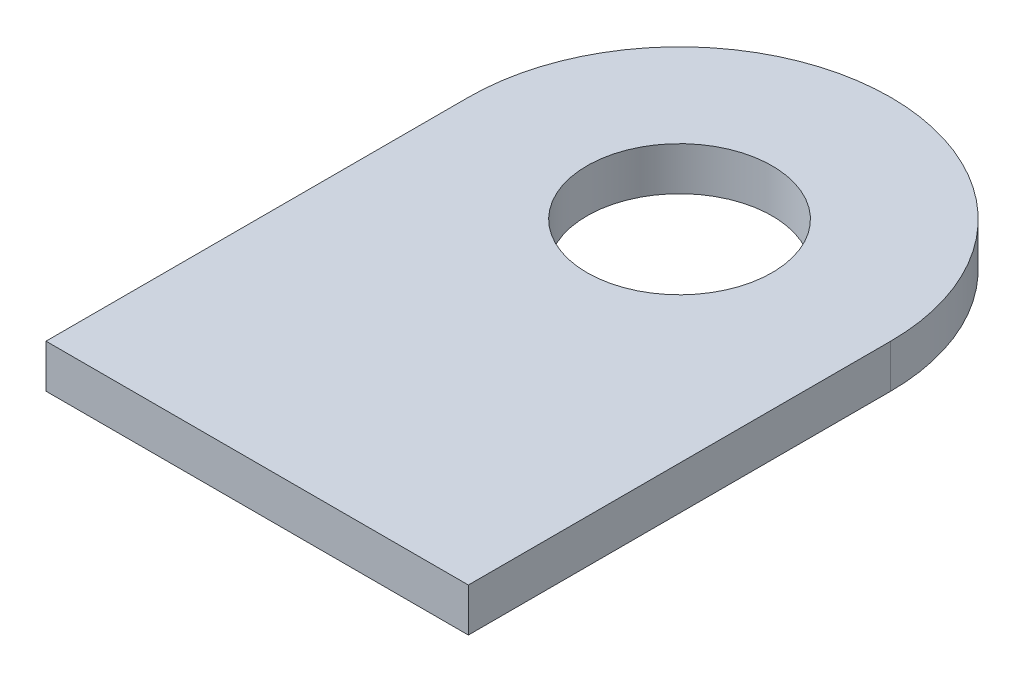
from build123d import *

# Parameters (mm, degrees)
SKETCH1_R           = 3.28803
BOSS_EXTRUDE1_DEPTH = 1.54


with BuildPart() as part:
    # Sketch1 → Boss-Extrude1 (new body)
    with BuildSketch(Plane(origin=(0, 0, 0), x_dir=(1, 0, 0), z_dir=(0, 1, 0))):
        with BuildLine():
            Line((0, 0), (15, 0))
            Line((15, 0), (15, 15))
            ThreePointArc((15, 15), (7.5, 22.5), (0, 15))
            Line((0, 15), (0, 0))
        make_face()
        with Locations(Location((7.5, 15, 0), (0, 0, 270))):
            Circle(SKETCH1_R, mode=Mode.SUBTRACT)
    extrude(amount=BOSS_EXTRUDE1_DEPTH)


solid = part.part
